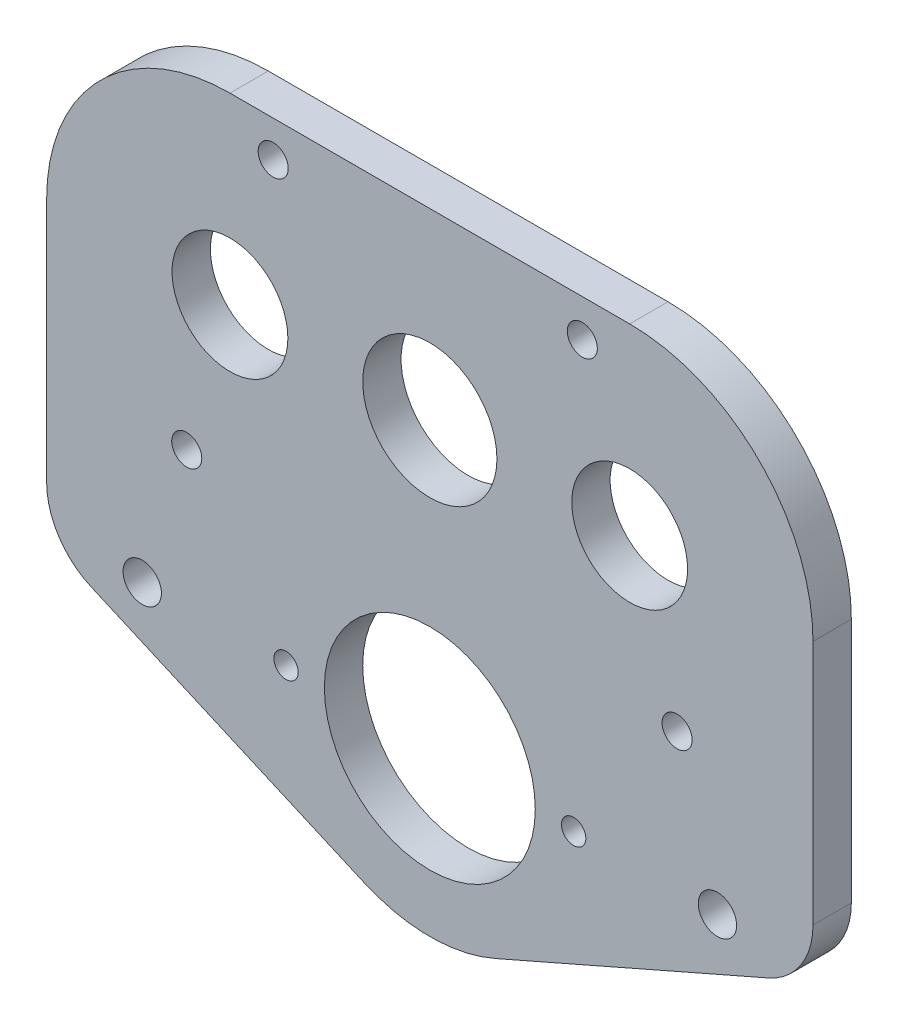
from build123d import *

# Parameters (mm, degrees)
SKETCH1_R           = 17.4625
SKETCH1_R_2         = 3.175
SKETCH1_R_3         = 2.0193
SKETCH1_R_4         = 11.1125
SKETCH1_R_5         = 9.5885
SKETCH1_R_6         = 2.4892
BOSS_EXTRUDE1_DEPTH = 3.175


with BuildPart() as part:
    # Sketch1 → Boss-Extrude1 (new, symmetric)
    with BuildSketch(Plane.XY):
        with BuildLine():
            Line((-63.4492, 47.0662), (-63.4492, 6.387701907))
            ThreePointArc((-63.4492, 6.387701907), (-61.443306044, -0.347944705), (-56.079239896, -4.888797072))
            Line((-56.079239896, -4.888797072), (-10.832597323, -24.718009456))
            ThreePointArc((-10.832597323, -24.718009456), (-5.8974e-05, -26.9875), (10.832489293, -24.7180568))
            Line((10.832489293, -24.7180568), (56.079190612, -4.8890544))
            ThreePointArc((56.079190612, -4.8890544), (61.443291325, -0.348202956), (63.4492, 6.387466177))
            Line((63.4492, 6.387466177), (63.4492, 47.0662))
            ThreePointArc((63.4492, 47.0662), (54.559012129, 68.529012129), (33.0962, 77.4192))
            Line((33.0962, 77.4192), (-33.0962, 77.4192))
            ThreePointArc((-33.0962, 77.4192), (-54.559012129, 68.529012129), (-63.4492, 47.0662))
        make_face()
        Circle(SKETCH1_R, mode=Mode.SUBTRACT)
        with Locations((47.625, 0)):
            Circle(SKETCH1_R_2, mode=Mode.SUBTRACT)
        with Locations((-23.8125, 0)):
            Circle(SKETCH1_R_3, mode=Mode.SUBTRACT)
        with Locations((-47.625, 0)):
            Circle(SKETCH1_R_2, mode=Mode.SUBTRACT)
        with Locations((23.8125, 0)):
            Circle(SKETCH1_R_3, mode=Mode.SUBTRACT)
        with Locations((0, 47.0662)):
            Circle(SKETCH1_R_4, mode=Mode.SUBTRACT)
        with Locations((33.0962, 47.0662)):
            Circle(SKETCH1_R_5, mode=Mode.SUBTRACT)
        with Locations((-33.0962, 47.0662)):
            Circle(SKETCH1_R_5, mode=Mode.SUBTRACT)
        with Locations((-25.940193056, 71.43732153)):
            Circle(SKETCH1_R_6, mode=Mode.SUBTRACT)
        with Locations((-40.252206944, 22.69507847)):
            Circle(SKETCH1_R_6, mode=Mode.SUBTRACT)
        with Locations((40.945231657, 22.909364486)):
            Circle(SKETCH1_R_6, mode=Mode.SUBTRACT)
        with Locations((25.247168343, 71.223035514)):
            Circle(SKETCH1_R_6, mode=Mode.SUBTRACT)
    extrude(amount=BOSS_EXTRUDE1_DEPTH, both=True)


solid = part.part
